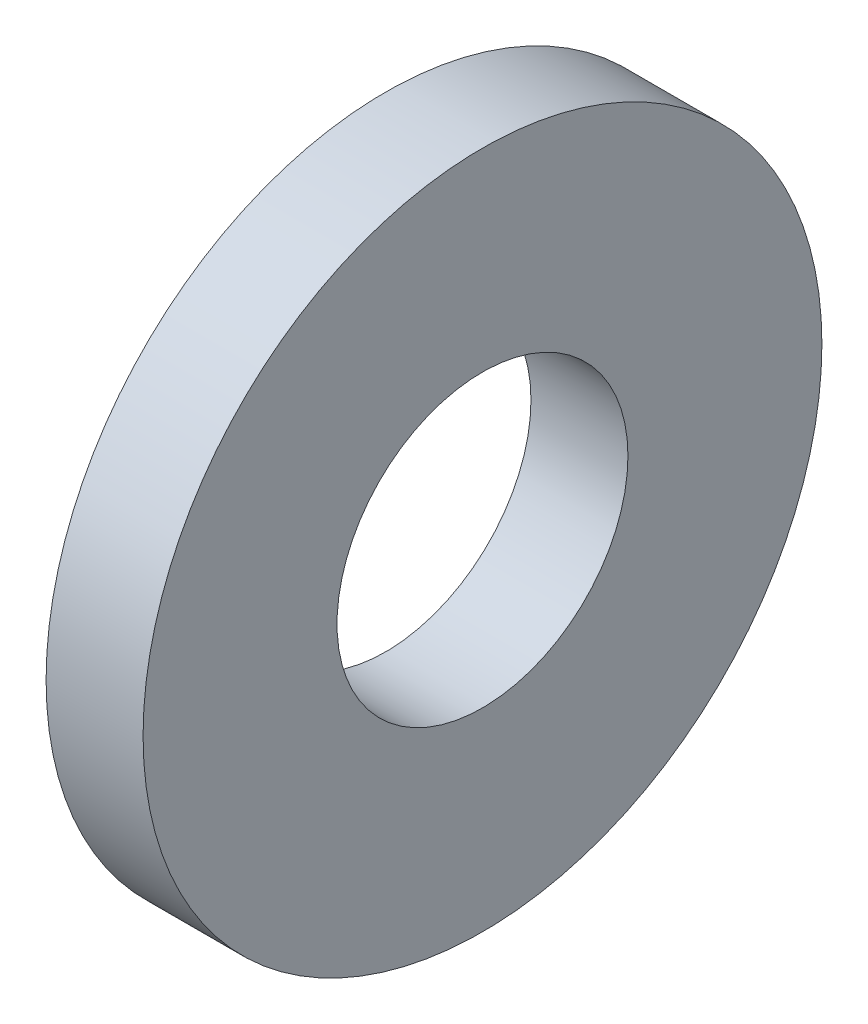
from build123d import *

# Parameters (mm, degrees)
SKETCH1_R           = 11.1125
SKETCH1_R_2         = 4.7625
BOSS_EXTRUDE1_DEPTH = 3.175


with BuildPart() as part:
    # Sketch1 → Boss-Extrude1 (new body)
    with BuildSketch(Plane(origin=(0, 0, 0), x_dir=(0, 0, -1), z_dir=(1, 0, 0))):
        Circle(SKETCH1_R)
        Circle(SKETCH1_R_2, mode=Mode.SUBTRACT)
    extrude(amount=BOSS_EXTRUDE1_DEPTH)


solid = part.part
